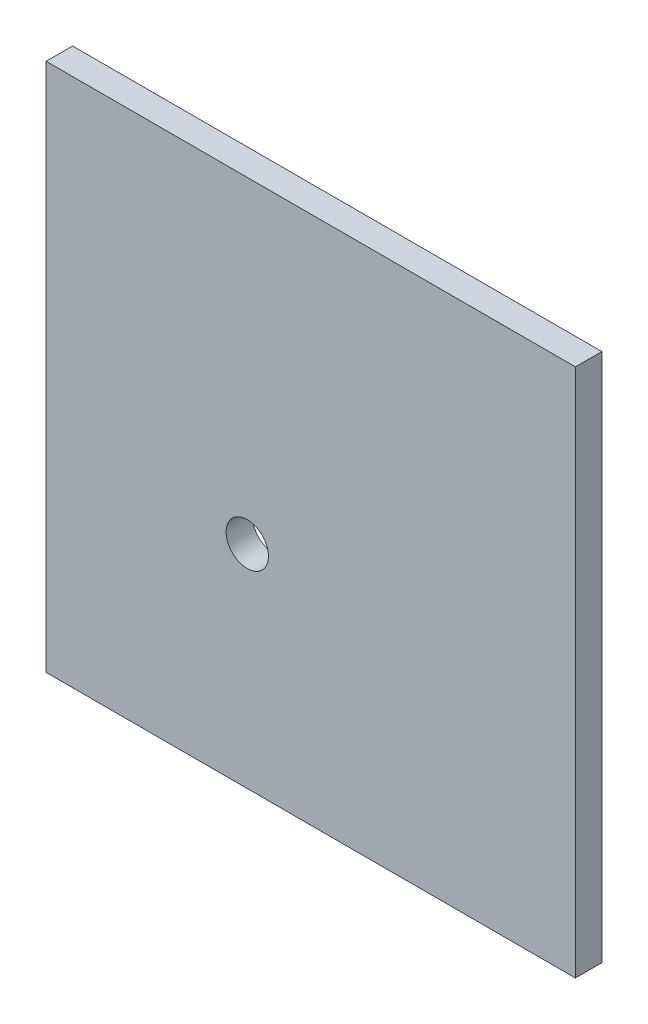
from build123d import *

# Parameters (mm, degrees)
SKETCH1_W           = 100
SKETCH1_H           = 100
BOSS_EXTRUDE1_DEPTH = 5
CUT_EXTRUDE1_REACH  = 72.887
SKETCH3_R           = 4


with BuildPart() as part:
    # Sketch1 → Boss-Extrude1 (new body)
    with BuildSketch(Plane.XY):
        Rectangle(SKETCH1_W, SKETCH1_H)
    extrude(amount=BOSS_EXTRUDE1_DEPTH)

    # Sketch3 → Cut-Extrude1 (cut, up to next)
    with BuildSketch(Plane.XY.offset(5), mode=Mode.PRIVATE) as cut_extrude1_sk1:
        with Locations((-12, -10)):
            Circle(SKETCH3_R)
    cut_extrude1_tool1 = extrude(cut_extrude1_sk1.sketch, amount=-CUT_EXTRUDE1_REACH, mode=Mode.PRIVATE) & part.part
    add(cut_extrude1_tool1.solids().sort_by_distance((-12, -10, 5))[0], mode=Mode.SUBTRACT)


solid = part.part
